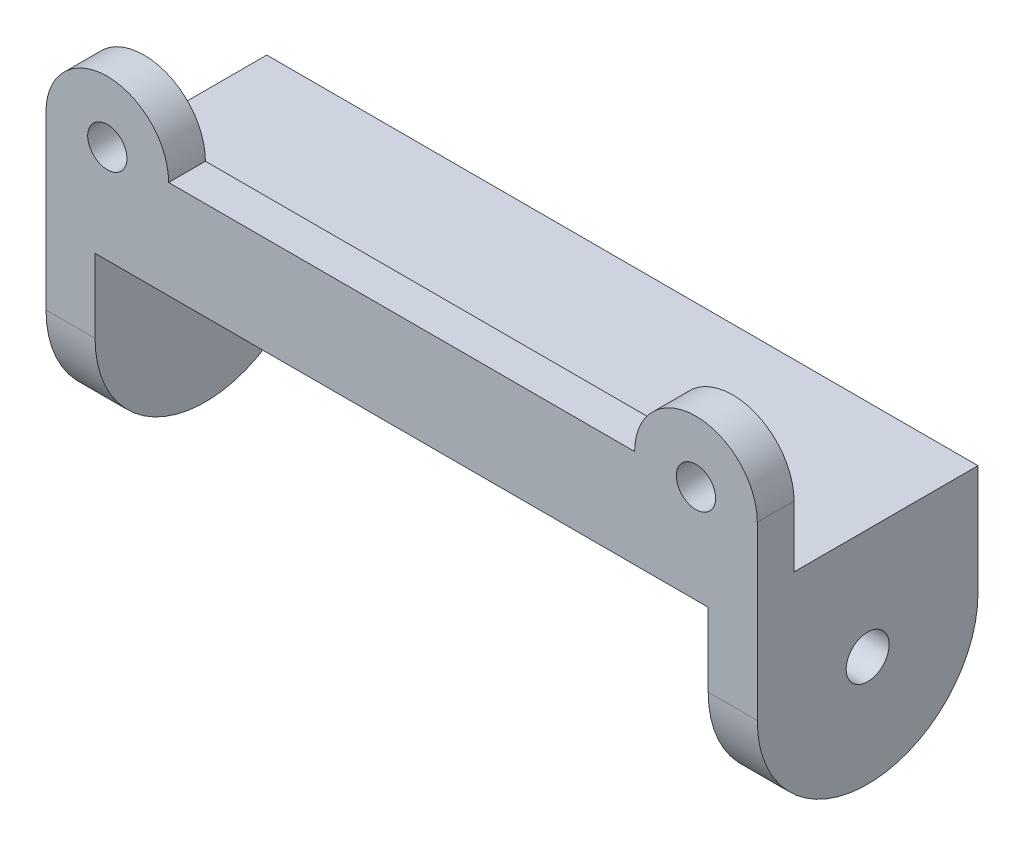
from build123d import *

# Parameters (mm, degrees)
SKETCH_3_R          = 1.6
EXTRUDE_2_DEPTH     = 3
SKETCH_4_W          = 58
SKETCH_4_H          = 3
EXTRUDE_3_DEPTH     = 18
SKETCH_5_R          = 1.75
EXTRUDE_4_DEPTH     = 4
SKETCH_7_R          = 8
CUT_EXTRUDE_2_DEPTH = 50


with BuildPart() as part:
    # 草图3 → 凸台-拉伸2 (new body)
    with BuildSketch(Plane.XY):
        with BuildLine():
            Line((-29, 0), (-29, -5))
            Line((-29, -5), (29, -5))
            Line((29, -5), (29, 0))
            ThreePointArc((29, 0), (24, 5), (19, 0))
            Line((19, 0), (-19, 0))
            ThreePointArc((-19, 0), (-24, 5), (-29, 0))
        make_face()
        with Locations((-24, 0)):
            Circle(SKETCH_3_R, mode=Mode.SUBTRACT)
        with Locations((24, 0)):
            Circle(SKETCH_3_R, mode=Mode.SUBTRACT)
    extrude(amount=EXTRUDE_2_DEPTH)

    # 草图4 → 凸台-拉伸3 (add)
    with BuildSketch(Plane.XY.offset(3)):
        with Locations((0, -6.5)):
            Rectangle(SKETCH_4_W, SKETCH_4_H)
    extrude(amount=-EXTRUDE_3_DEPTH)

    # 草图5 → 凸台-拉伸4 (add)
    with BuildSketch(Plane(origin=(29, 0, 0), x_dir=(0, 0, -1), z_dir=(1, 0, 0))):
        with BuildLine():
            Line((-3, -8), (-3, -14))
            ThreePointArc((-3, -14), (6, -23), (15, -14))
            Line((15, -14), (15, -8))
            Line((15, -8), (-3, -8))
        make_face()
        with Locations((6, -14)):
            Circle(SKETCH_5_R, mode=Mode.SUBTRACT)
    extrude_4 = extrude(amount=-EXTRUDE_4_DEPTH)

    # 镜向1: 凸台-拉伸4 across plane
    add(extrude_4.mirror(Plane(origin=(0, 0, 0), x_dir=(0, 0, 1), z_dir=(1, 0, 0))))

    # 草图7 → 切除-拉伸2 (cut)
    with BuildSketch(Plane.ZY.offset(-25)):
        with Locations((-6, -14)):
            Circle(SKETCH_7_R)
    extrude(amount=CUT_EXTRUDE_2_DEPTH, mode=Mode.SUBTRACT)


solid = part.part
